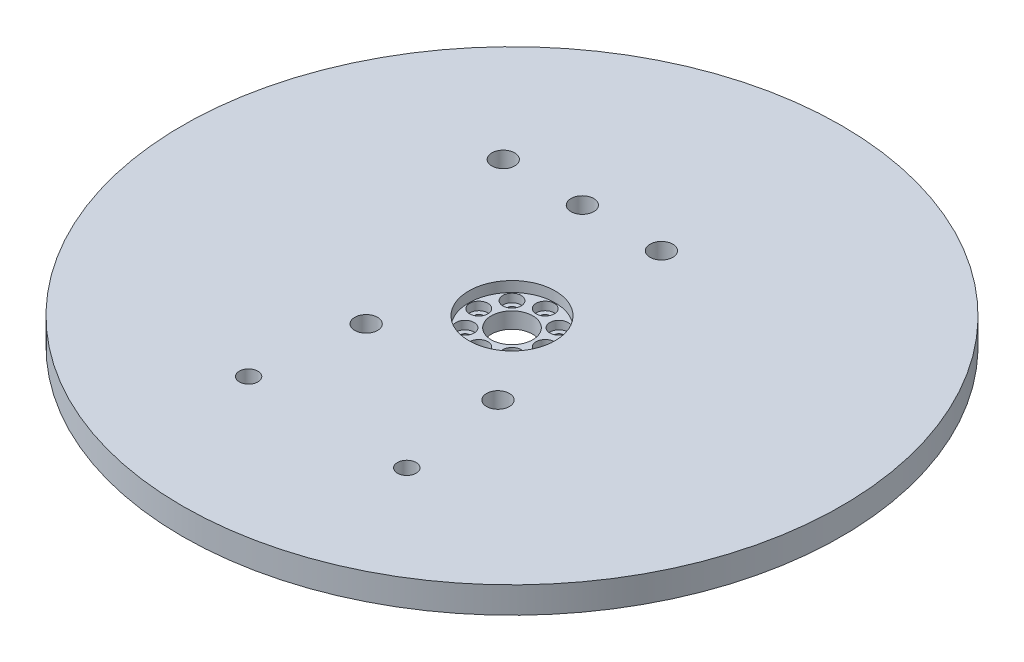
from build123d import *

# Parameters (mm, degrees)
SKETCH1_R                      = 79.375
BOSS_EXTRUDE1_DEPTH            = 3.175
SKETCH5_R                      = 10.4
CUT_EXTRUDE1_DEPTH             = 2.5
SKETCH6_R                      = 5
CUT_EXTRUDE2_DEPTH             = 113.432663181
CBORE_FOR_M2_SHCS1_D           = 2.2
CBORE_FOR_M2_SHCS1_DEPTH       = 6
CBORE_FOR_M2_SHCS1_CBORE_D     = 4.4
CBORE_FOR_M2_SHCS1_CBORE_DEPTH = 2
CBORE_FOR_M2_SHCS1_TIP         = 0.660946681
M4_CLEARANCE_HOLE1_D           = 4.5
M5_CLEARANCE_HOLE1_D           = 5.5


with BuildPart() as part:
    # Sketch1 → Boss-Extrude1 (new, symmetric)
    with BuildSketch(Plane(origin=(0, 0, 0), x_dir=(1, 0, 0), z_dir=(0, 1, 0))):
        with Locations(Location((0, 0, 0), (0, 0, 270))):
            Circle(SKETCH1_R)
    extrude(amount=BOSS_EXTRUDE1_DEPTH, both=True)

    # Sketch5 → Cut-Extrude1 (cut)
    with BuildSketch(Plane(origin=(0, 3.175, 0), x_dir=(1, 0, 0), z_dir=(0, 1, 0))):
        with Locations(Location((0, 0, 0), (0, 0, 270))):
            Circle(SKETCH5_R)
    extrude(amount=-CUT_EXTRUDE1_DEPTH, mode=Mode.SUBTRACT)

    # Sketch6 → Cut-Extrude2 (cut, through all)
    with BuildSketch(Plane(origin=(0, 3.175, 0), x_dir=(1, 0, 0), z_dir=(0, 1, 0))):
        with Locations(Location((0, 0, 0), (0, 0, 270))):
            Circle(SKETCH6_R)
    extrude(amount=-CUT_EXTRUDE2_DEPTH, mode=Mode.SUBTRACT)

    # CBORE for M2 SHCS1
    with Locations(Plane(origin=(0, 0.675, 0), x_dir=(1, 0, 0), z_dir=(0, 1, 0))):
        with Locations((-5.65685425, 5.65685425), (0, 8), (5.65685425, 5.65685425), (8, 0), (5.65685425, -5.65685425), (0, -8), (-5.65685425, -5.65685425), (-8, 0)):
            CounterBoreHole(CBORE_FOR_M2_SHCS1_D / 2, CBORE_FOR_M2_SHCS1_CBORE_D / 2, CBORE_FOR_M2_SHCS1_CBORE_DEPTH, depth=CBORE_FOR_M2_SHCS1_DEPTH)
            with Locations((0, 0, -(CBORE_FOR_M2_SHCS1_DEPTH + CBORE_FOR_M2_SHCS1_TIP / 2))):  # 118° drill point
                Cone(0, CBORE_FOR_M2_SHCS1_D / 2, CBORE_FOR_M2_SHCS1_TIP, mode=Mode.SUBTRACT)

    # M4 Clearance Hole1 (through all)
    with Locations(Plane(origin=(0, 3.175, 0), x_dir=(1, 0, 0), z_dir=(0, 1, 0))):
        with Locations((19.05, -44.388212048), (-19.05, -44.388212048)):
            Hole(M4_CLEARANCE_HOLE1_D / 2)

    # M5 Clearance Hole1 (through all)
    with Locations(Plane(origin=(0, 3.175, 0), x_dir=(1, 0, 0), z_dir=(0, 1, 0))):
        with Locations((-33.6688086, 31.567387952), (-14.6188086, 31.567387952), (4.4311914, 31.567387952), (-15.875, -19.249706448), (15.875, -19.249706448)):
            Hole(M5_CLEARANCE_HOLE1_D / 2)


solid = part.part
